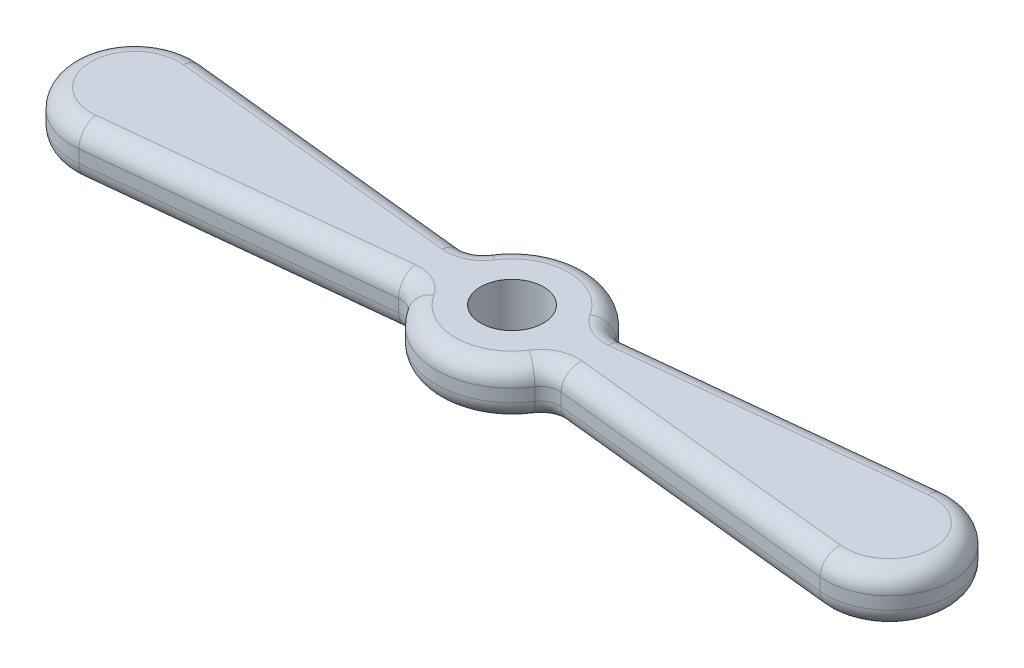
from build123d import *

# Parameters (mm, degrees)
SKETCH1_R           = 5
BOSS_EXTRUDE2_DEPTH = 8
FILLET1_R           = 3
FILLET2_R           = 3


with BuildPart() as part:
    # Sketch1 → Boss-Extrude2 (new body)
    with BuildSketch(Plane(origin=(0, 0, 0), x_dir=(1, 0, 0), z_dir=(0, 1, 0))):
        with BuildLine():
            Line((-58.954715367, 9.945218954), (-10.953934927, 4.900133633))
            ThreePointArc((-10.953934927, 4.900133633), (0, 12), (10.953934927, 4.900133633))
            Line((10.953934927, 4.900133633), (58.954715367, 9.945218954))
            ThreePointArc((58.954715367, 9.945218954), (70, 0), (58.954715367, -9.945218954))
            Line((58.954715367, -9.945218954), (10.953934927, -4.900133633))
            ThreePointArc((10.953934927, -4.900133633), (0, -12), (-10.953934927, -4.900133633))
            Line((-10.953934927, -4.900133633), (-58.954715367, -9.945218954))
            ThreePointArc((-58.954715367, -9.945218954), (-70, 0), (-58.954715367, 9.945218954))
        make_face()
        with Locations(Location((0, 0, 0), (0, 0, 270))):
            Circle(SKETCH1_R, mode=Mode.SUBTRACT)
    extrude(amount=BOSS_EXTRUDE2_DEPTH)

    # Fillet1
    fillet1_edges = [part.edges().sort_by_distance(p)[0] for p in [
        (-10.953934927, 4, -4.900133633),
        (10.953934927, 4, -4.900133633),
        (10.953934927, 4, 4.900133633),
        (-10.953934927, 4, 4.900133633),
    ]]
    fillet(fillet1_edges, radius=FILLET1_R)

    # Fillet2
    fillet2_edges = [part.edges().sort_by_distance(p)[0] for p in [
        (-35.948953134, 0, 7.527215907),
        (-70, 0, 0),
        (70, 8, 0),
        (35.948953134, 8, -7.527215907),
        (-35.948953134, 0, -7.527215907),
        (-35.948953134, 8, -7.527215907),
        (0, 0, -12),
        (0, 8, -12),
        (0, 0, 12),
        (0, 8, 12),
        (35.948953134, 0, 7.527215907),
        (35.948953134, 8, 7.527215907),
        (-11.32982846, 0, -5.388970193),
        (-11.32982846, 8, -5.388970193),
        (-11.32982846, 0, 5.388970193),
        (-11.32982846, 8, 5.388970193),
        (11.32982846, 0, -5.388970193),
        (11.32982846, 8, -5.388970193),
        (11.32982846, 0, 5.388970193),
        (11.32982846, 8, 5.388970193),
        (-70, 8, 0),
        (-35.948953134, 8, 7.527215907),
        (35.948953134, 0, -7.527215907),
        (70, 0, 0),
    ]]
    fillet(fillet2_edges, radius=FILLET2_R)


solid = part.part
